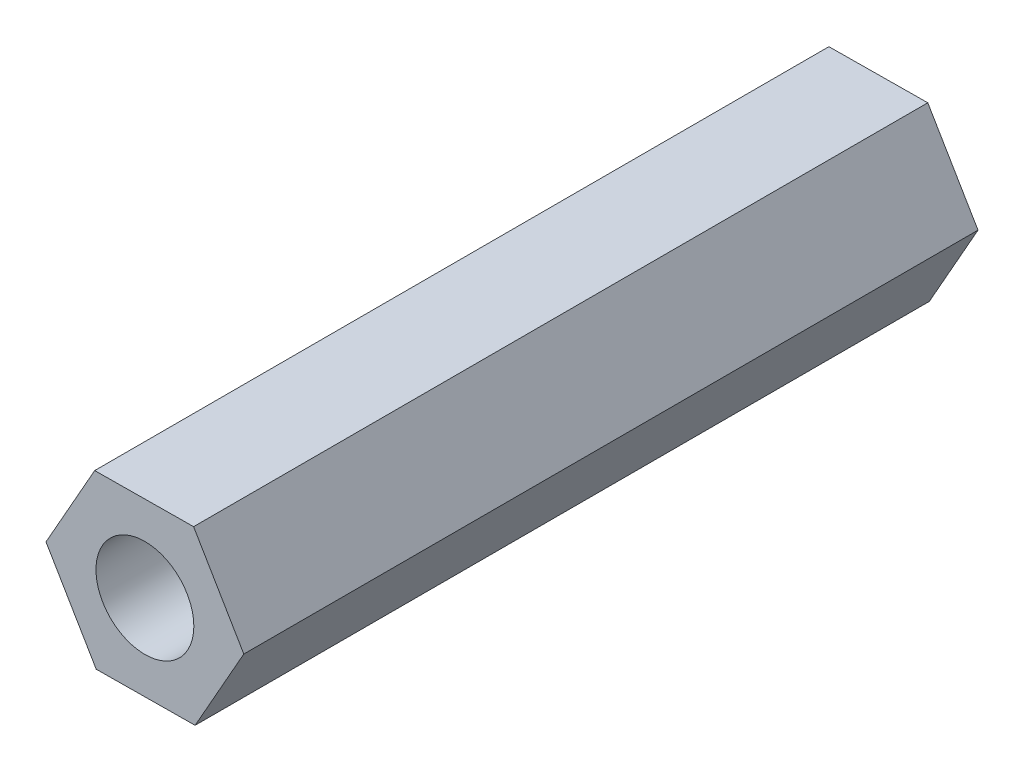
from build123d import *

# Parameters (mm, degrees)
SKETCH_1_R      = 2
EXTRUDE_1_DEPTH = 30


with BuildPart() as part:
    # 草图1 → 凸台-拉伸1 (new body)
    with BuildSketch(Plane.XY):
        Polygon((2.051456248, -3.482077052), (4.041295309, 0.035574699), (1.989839061, 3.517651751), (-2.051456248, 3.482077052), (-4.041295309, -0.035574699), (-1.989839061, -3.517651751), align=None)
        Circle(SKETCH_1_R, mode=Mode.SUBTRACT)
    extrude(amount=EXTRUDE_1_DEPTH)


solid = part.part
